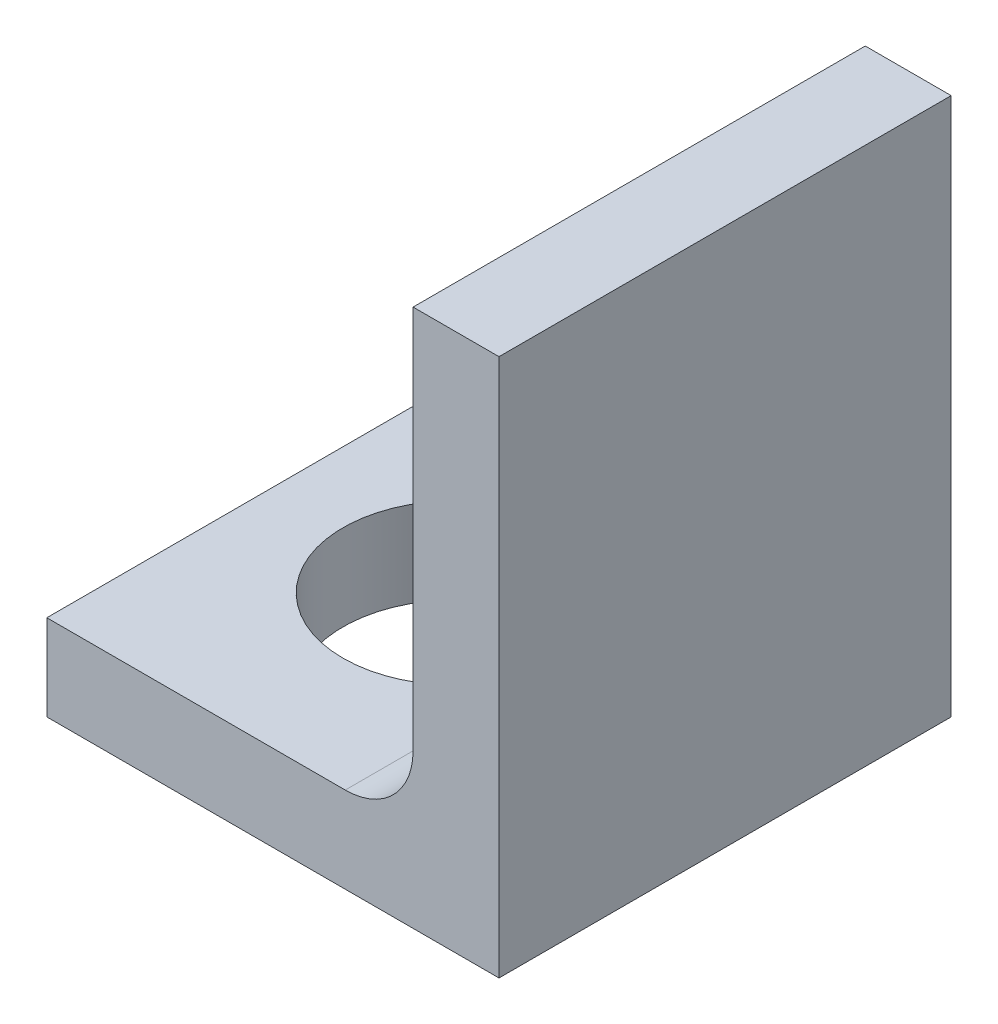
from build123d import *

# Parameters (mm, degrees)
SKETCH1_W           = 20
SKETCH1_H           = 3.8
BOSS_EXTRUDE1_DEPTH = 20
SKETCH2_W           = 3.8
SKETCH2_H           = 20
BOSS_EXTRUDE2_DEPTH = 20
SKETCH3_R           = 5
CUT_EXTRUDE1_DEPTH  = 30
FILLET1_R           = 3


with BuildPart() as part:
    # Sketch1 → Boss-Extrude1 (new body)
    with BuildSketch(Plane.XY):
        with Locations((10, -1.9)):
            Rectangle(SKETCH1_W, SKETCH1_H)
    extrude(amount=BOSS_EXTRUDE1_DEPTH)

    # Sketch2 → Boss-Extrude2 (add)
    with BuildSketch(Plane(origin=(0, 0, 0), x_dir=(1, 0, 0), z_dir=(0, 1, 0))):
        with Locations((18.1, -10)):
            Rectangle(SKETCH2_W, SKETCH2_H)
    extrude(amount=BOSS_EXTRUDE2_DEPTH)

    # Sketch3 → Cut-Extrude1 (cut)
    with BuildSketch(Plane(origin=(0, 0, 0), x_dir=(1, 0, 0), z_dir=(0, 1, 0))):
        with Locations(Location((8.1, -10, 0), (0, 0, 270))):
            Circle(SKETCH3_R)
    extrude(amount=-CUT_EXTRUDE1_DEPTH, mode=Mode.SUBTRACT)

    # Fillet1
    fillet1_edges = [part.edges().sort_by_distance(p)[0] for p in [
        (16.2, 0, 10),
    ]]
    fillet(fillet1_edges, radius=FILLET1_R)


solid = part.part
